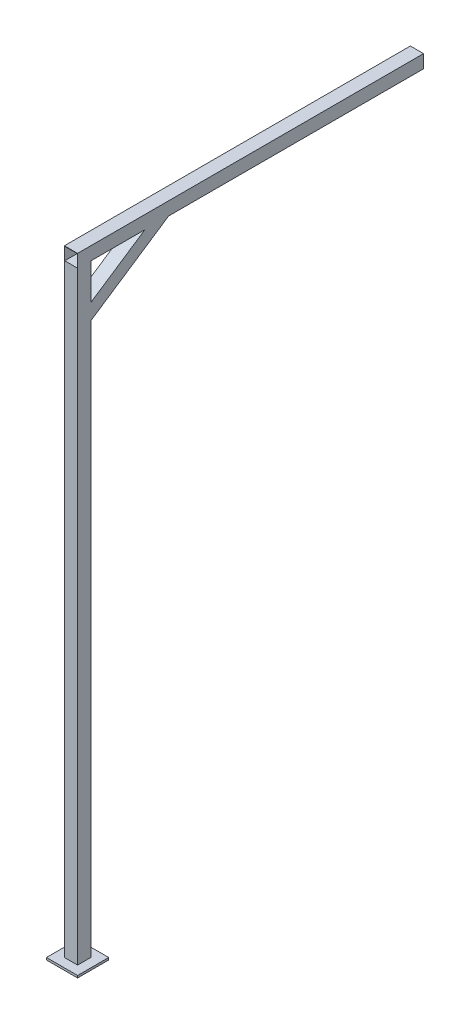
from build123d import *

# Parameters (mm, degrees)
CROQUIS1_W              = 76.2
CROQUIS1_H              = 76.2
CROQUIS1_W_2            = 72.4
CROQUIS1_H_2            = 72.4
SALIENTE_EXTRUIR1_DEPTH = 2000
CROQUIS2_W              = 76.2
CROQUIS2_H              = 76.2
CROQUIS2_W_2            = 72.4
CROQUIS2_H_2            = 72.4
SALIENTE_EXTRUIR2_DEPTH = 3500
CROQUIS3_W              = 180
CROQUIS3_H              = 180
SALIENTE_EXTRUIR3_DEPTH = 12.7
SALIENTE_EXTRUIR4_DEPTH = 76.2


with BuildPart() as part:
    # Croquis1 → Saliente-Extruir1 (new body)
    with BuildSketch(Plane.XY):
        with Locations((38.1, -38.1)):
            Rectangle(CROQUIS1_W, CROQUIS1_H)
        with Locations((38.1, -38.1)):
            Rectangle(CROQUIS1_W_2, CROQUIS1_H_2, mode=Mode.SUBTRACT)
    extrude(amount=SALIENTE_EXTRUIR1_DEPTH)

    # Croquis2 → Saliente-Extruir2 (add)
    with BuildSketch(Plane.XZ.offset(76.2)):
        with Locations((38.1, 1961.9)):
            Rectangle(CROQUIS2_W, CROQUIS2_H)
        with Locations((38.1, 1961.9)):
            Rectangle(CROQUIS2_W_2, CROQUIS2_H_2, mode=Mode.SUBTRACT)
    extrude(amount=SALIENTE_EXTRUIR2_DEPTH)

    # Croquis3 → Saliente-Extruir3 (add)
    with BuildSketch(Plane.XZ.offset(3576.2)):
        with Locations((38.1, 1961.9)):
            Rectangle(CROQUIS3_W, CROQUIS3_H)
    extrude(amount=-SALIENTE_EXTRUIR3_DEPTH)

    # Croquis4 → Saliente-Extruir4 (add)
    with BuildSketch(Plane(origin=(76.2, 0, 0), x_dir=(0, 0, -1), z_dir=(1, 0, 0))):
        Polygon((-1473.8, -76.2), (-1923.8, -376.2), (-1923.8, -284.618997603), (-1611.171503595, -76.2), align=None)
    extrude(amount=-SALIENTE_EXTRUIR4_DEPTH)


solid = part.part
